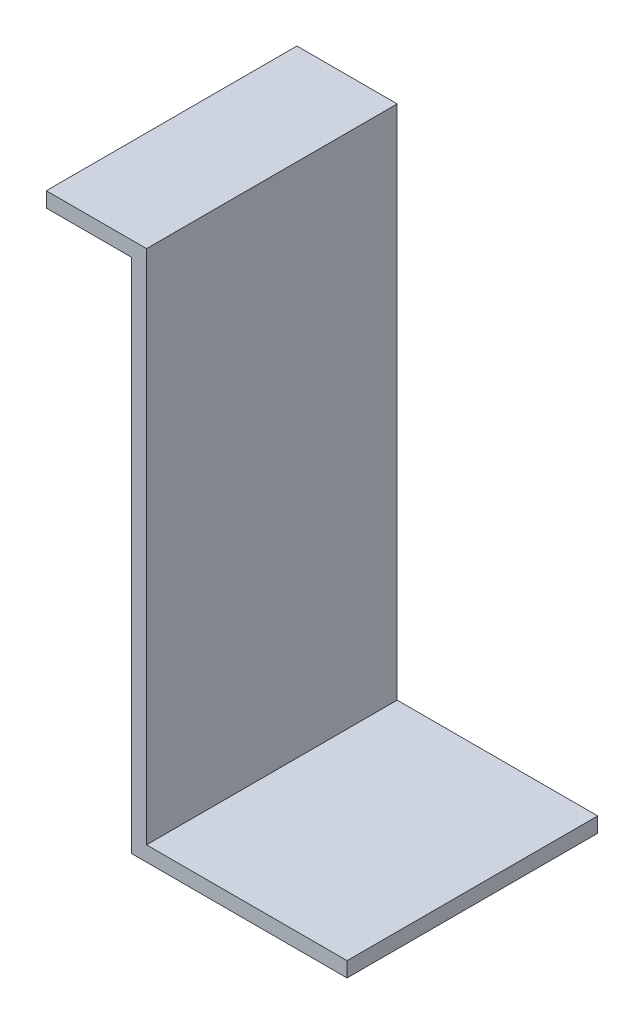
from build123d import *

# Parameters (mm, degrees)
SKETCH1_W      = 43
SKETCH1_H      = 50
EXTRUDE1_DEPTH = 3
SKETCH2_W      = 3
SKETCH2_H      = 50
EXTRUDE2_DEPTH = 100
SKETCH3_W      = 20
SKETCH3_H      = 50
EXTRUDE3_DEPTH = 3


with BuildPart() as part:
    # Sketch1 → Extrude1 (new body)
    with BuildSketch(Plane(origin=(0, 0, 0), x_dir=(1, 0, 0), z_dir=(0, 1, 0))):
        with Locations((21.5, 25)):
            Rectangle(SKETCH1_W, SKETCH1_H)
    extrude(amount=EXTRUDE1_DEPTH)

    # Sketch2 → Extrude2 (add)
    with BuildSketch(Plane(origin=(0, 3, 0), x_dir=(1, 0, 0), z_dir=(0, 1, 0))):
        with Locations((1.5, 25)):
            Rectangle(SKETCH2_W, SKETCH2_H)
    extrude(amount=EXTRUDE2_DEPTH)

    # Sketch3 → Extrude3 (add)
    with BuildSketch(Plane(origin=(0, 103, 0), x_dir=(1, 0, 0), z_dir=(0, 1, 0))):
        with Locations((-7, 25)):
            Rectangle(SKETCH3_W, SKETCH3_H)
    extrude(amount=EXTRUDE3_DEPTH)


solid = part.part
